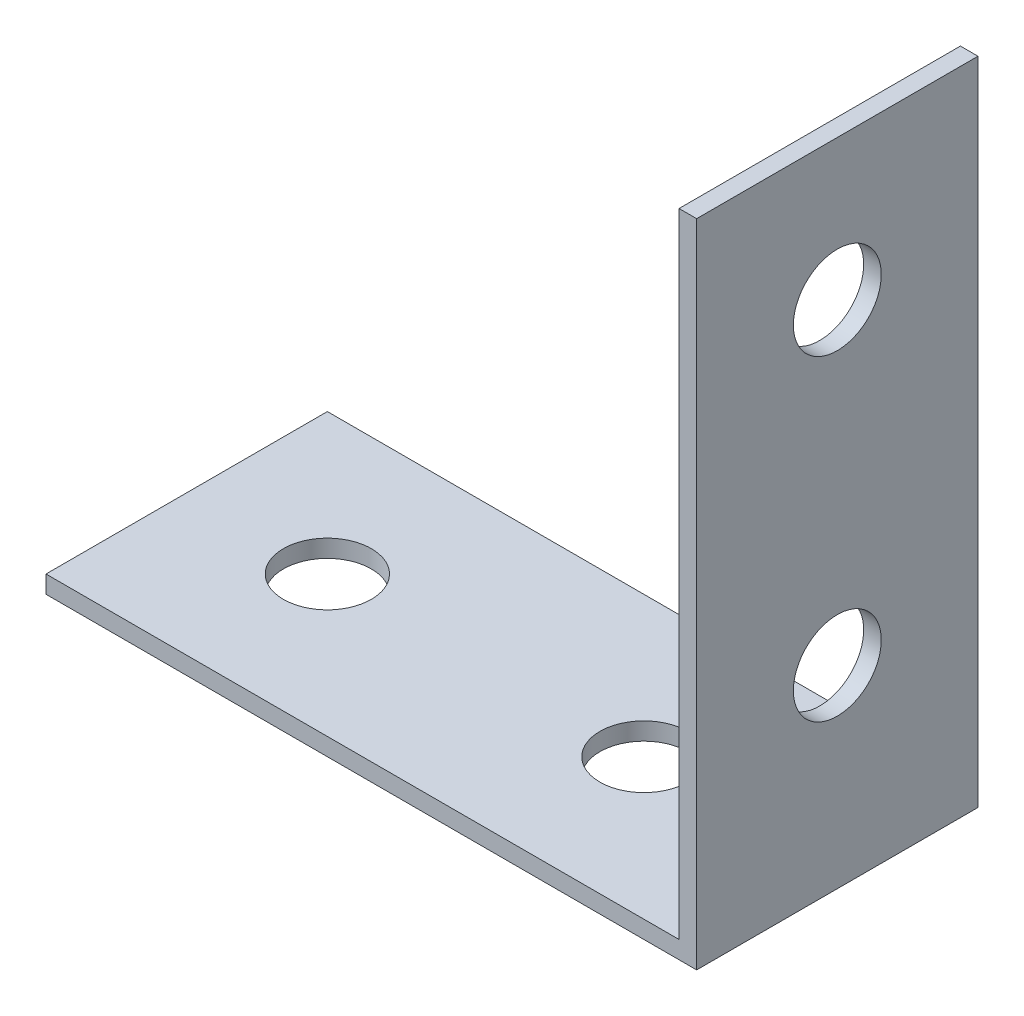
from build123d import *

# Parameters (mm, degrees)
SKETCH_1_W          = 36
SKETCH_1_H          = 16
EXTRUDE_1_DEPTH     = 1
SKETCH_2_W          = 16
SKETCH_2_H          = 37
EXTRUDE_2_DEPTH     = 1
CUT_EXTRUDE_1_REACH = 43.485
SKETCH_3_R          = 2.5
CUT_EXTRUDE_2_REACH = 54.24
SKETCH_4_R          = 2.5


with BuildPart() as part:
    # 草圖1 → 填料-伸長1 (new body)
    with BuildSketch(Plane(origin=(0, 0, 0), x_dir=(1, 0, 0), z_dir=(0, 1, 0))):
        Rectangle(SKETCH_1_W, SKETCH_1_H)
    extrude(amount=EXTRUDE_1_DEPTH)

    # 草圖2 → 填料-伸長2 (add)
    with BuildSketch(Plane(origin=(18, 0, 0), x_dir=(0, 0, -1), z_dir=(1, 0, 0))):
        with Locations((0, 18.5)):
            Rectangle(SKETCH_2_W, SKETCH_2_H)
    extrude(amount=EXTRUDE_2_DEPTH)

    # 草圖3 → 除料-伸長1 (cut, up to next)
    with BuildSketch(Plane(origin=(0, 1, 0), x_dir=(1, 0, 0), z_dir=(0, 1, 0)), mode=Mode.PRIVATE) as cut_extrude_1_sk1:
        with Locations(Location((-10, 0, 0), (0, 0, 270))):
            Circle(SKETCH_3_R)
    cut_extrude_1_tool1 = extrude(cut_extrude_1_sk1.sketch, amount=-CUT_EXTRUDE_1_REACH, mode=Mode.PRIVATE) & part.part
    # 草圖3 → 除料-伸長1 (cut, up to next)
    with BuildSketch(Plane(origin=(0, 1, 0), x_dir=(1, 0, 0), z_dir=(0, 1, 0)), mode=Mode.PRIVATE) as cut_extrude_1_sk2:
        with Locations(Location((8, 0, 0), (0, 0, 270))):
            Circle(SKETCH_3_R)
    cut_extrude_1_tool2 = extrude(cut_extrude_1_sk2.sketch, amount=-CUT_EXTRUDE_1_REACH, mode=Mode.PRIVATE) & part.part
    add(cut_extrude_1_tool1.solids().sort_by_distance((-10, 1, 0))[0], mode=Mode.SUBTRACT)
    add(cut_extrude_1_tool2.solids().sort_by_distance((8, 1, 0))[0], mode=Mode.SUBTRACT)

    # 草圖4 → 除料-伸長2 (cut, up to next)
    with BuildSketch(Plane.ZY.offset(-18), mode=Mode.PRIVATE) as cut_extrude_2_sk1:
        with Locations((0, 29)):
            Circle(SKETCH_4_R)
    cut_extrude_2_tool1 = extrude(cut_extrude_2_sk1.sketch, amount=-CUT_EXTRUDE_2_REACH, mode=Mode.PRIVATE) & part.part
    # 草圖4 → 除料-伸長2 (cut, up to next)
    with BuildSketch(Plane.ZY.offset(-18), mode=Mode.PRIVATE) as cut_extrude_2_sk2:
        with Locations((0, 11)):
            Circle(SKETCH_4_R)
    cut_extrude_2_tool2 = extrude(cut_extrude_2_sk2.sketch, amount=-CUT_EXTRUDE_2_REACH, mode=Mode.PRIVATE) & part.part
    add(cut_extrude_2_tool1.solids().sort_by_distance((18, 29, 0))[0], mode=Mode.SUBTRACT)
    add(cut_extrude_2_tool2.solids().sort_by_distance((18, 11, 0))[0], mode=Mode.SUBTRACT)


solid = part.part
